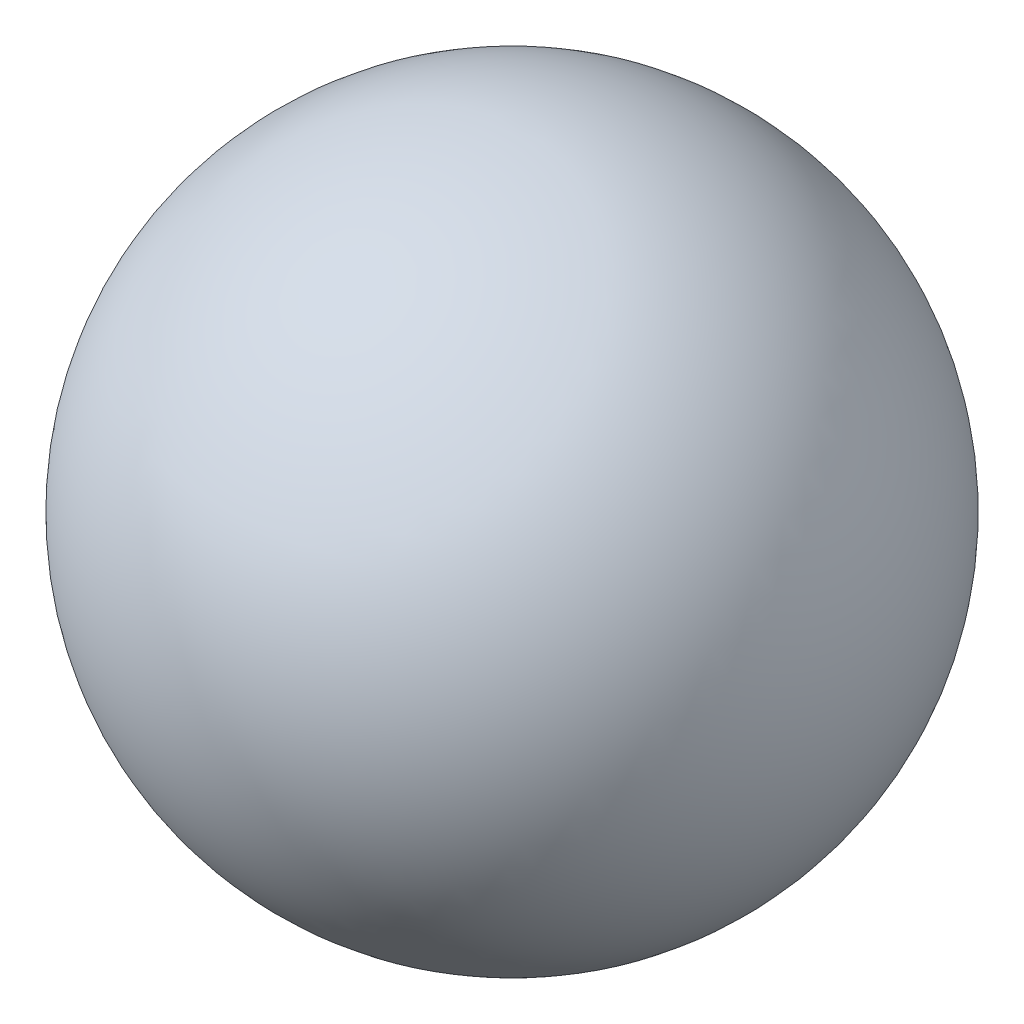
from build123d import *


with BuildPart() as part:
    # Sketch1 → Revolve1 (revolve)
    with BuildSketch(Plane.XY):
        with BuildLine():
            Line((0, 400), (0, 300))
            ThreePointArc((0, 300), (300, 0), (0, -300))
            Line((0, -300), (0, -400))
            ThreePointArc((0, -400), (400, 0), (0, 400))
        make_face()
    revolve(axis=Axis((0, 116.844669118, 0), (0, -1, 0)))


solid = part.part
